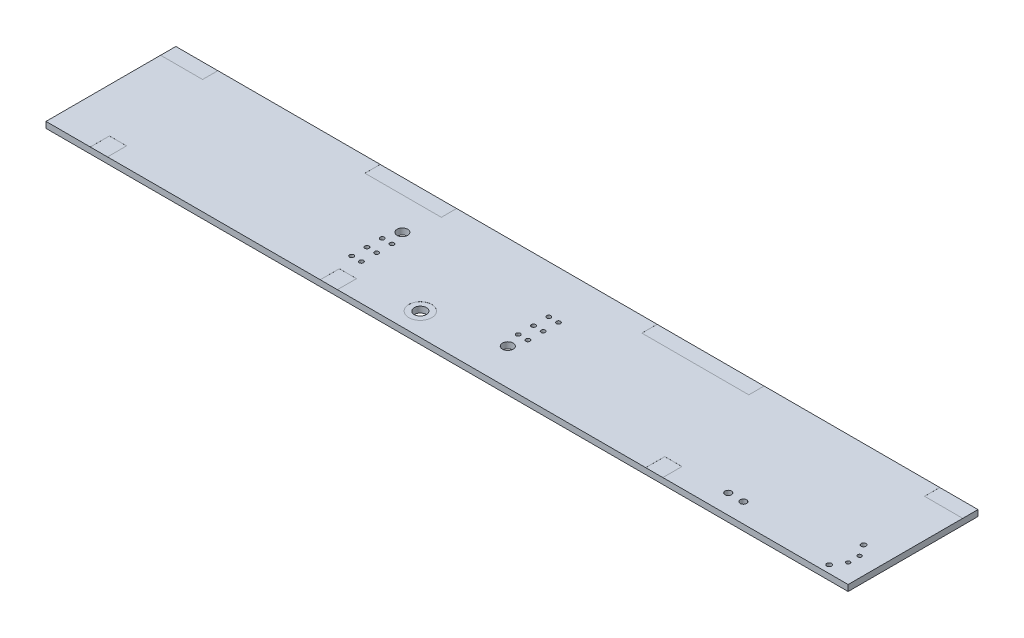
from build123d import *

# Parameters (mm, degrees)
ESQUISSE1_W                     = 210
ESQUISSE1_H                     = 1.6
BOARD_DEPTH                     = 34
SKETCH1_R                       = 0.55
SKETCH1_R_2                     = 1.4
REMOVEABLE_BATT_CON_HOLES_DEPTH = 118.625713289
SKETCH2_R                       = 0.51
SKETCH2_R_2                     = 0.635
DC_OUT_CONN_HOLES_DEPTH         = 118.625713289
SKETCH3_R                       = 0.85
CHARGER_CONN_HOLES_DEPTH        = 118.625713289
SKETCH4_R                       = 1.59
CUT_EXTRUDE1_DEPTH              = 118.625713289
SKETCH5_R                       = 3
SKETCH5_W                       = 10
SKETCH5_H                       = 4
SKETCH5_W_2                     = 28
SKETCH5_W_3                     = 20
SKETCH5_W_4                     = 11
SKETCH5_W_5                     = 4.5
SKETCH5_H_2                     = 5
CUT_EXTRUDE2_DEPTH              = 0.01
CUT_EXTRUDE3_START              = -1.59
SKETCH5_2_R                     = 3
SKETCH5_2_W                     = 10
SKETCH5_2_H                     = 4
SKETCH5_2_W_2                   = 28
SKETCH5_2_W_3                   = 20
SKETCH5_2_W_4                   = 11
SKETCH5_2_W_5                   = 4.5
SKETCH5_2_H_2                   = 5
CUT_EXTRUDE3_DEPTH              = 0.01
SKETCH6_W                       = 8
SKETCH6_H                       = 18
CUT_EXTRUDE4_DEPTH              = 0.001
SKETCH7_R                       = 4
BOSS_EXTRUDE1_DEPTH             = 10.2
BOSS_EXTRUDE2_DEPTH             = 3


with BuildPart() as part:
    # Esquisse1 → Board (new body)
    with BuildSketch(Plane.XY):
        with Locations((-7.593287663, -121.91)):
            Rectangle(ESQUISSE1_W, ESQUISSE1_H)
    extrude(amount=BOARD_DEPTH)

    # Sketch1 → Removeable Batt Con Holes (cut, through all)
    with BuildSketch(Plane(origin=(0, -122.71, 0), x_dir=(1, 0, 0), z_dir=(0, 1, 0))):
        with Locations(Location((-39.523287663, -16.5, 0), (0, 0, 180))):
            Circle(SKETCH1_R)
        with Locations(Location((-42.063287663, -16.5, 0), (0, 0, 180))):
            Circle(SKETCH1_R)
        with Locations(Location((-42.063287663, -20.5, 0), (0, 0, 180))):
            Circle(SKETCH1_R)
        with Locations(Location((-42.063287663, -24.5, 0), (0, 0, 180))):
            Circle(SKETCH1_R)
        with Locations((-40.793287663, -12.5)):
            Circle(SKETCH1_R_2)
        with Locations(Location((-39.523287663, -20.5, 0), (0, 0, 180))):
            Circle(SKETCH1_R)
        with Locations(Location((-39.523287663, -24.5, 0), (0, 0, 180))):
            Circle(SKETCH1_R)
        with Locations(Location((-2.463287663, -20.5, 0), (0, 0, 180))):
            Circle(SKETCH1_R)
        with Locations(Location((0.076712337, -20.5, 0), (0, 0, 180))):
            Circle(SKETCH1_R)
        with Locations(Location((-2.463287663, -16.5, 0), (0, 0, 180))):
            Circle(SKETCH1_R)
        with Locations(Location((0.076712337, -16.5, 0), (0, 0, 180))):
            Circle(SKETCH1_R)
        with Locations(Location((-2.463287663, -12.5, 0), (0, 0, 180))):
            Circle(SKETCH1_R)
        with Locations(Location((0.076712337, -12.5, 0), (0, 0, 180))):
            Circle(SKETCH1_R)
        with Locations((-1.193287663, -24.5)):
            Circle(SKETCH1_R_2)
    extrude(amount=REMOVEABLE_BATT_CON_HOLES_DEPTH, mode=Mode.SUBTRACT)

    # Sketch2 → DC Out Conn holes (cut, through all)
    with BuildSketch(Plane.XZ.offset(122.71)):
        with Locations((92.406712337, 29)):
            Circle(SKETCH2_R)
        with Locations((92.406712337, 26)):
            Circle(SKETCH2_R)
        with Locations((90.446712337, 32)):
            Circle(SKETCH2_R_2)
        with Locations((90.446712337, 23)):
            Circle(SKETCH2_R_2)
    extrude(amount=-DC_OUT_CONN_HOLES_DEPTH, mode=Mode.SUBTRACT)

    # Sketch3 → Charger conn holes (cut, through all)
    with BuildSketch(Plane.XZ.offset(122.71)):
        with Locations((64.906712337, 28.92)):
            Circle(SKETCH3_R)
        with Locations((60.946712337, 28.92)):
            Circle(SKETCH3_R)
    extrude(amount=-CHARGER_CONN_HOLES_DEPTH, mode=Mode.SUBTRACT)

    # Sketch4 → Cut-Extrude1 (cut, through all)
    with BuildSketch(Plane(origin=(0, -121.11, 0), x_dir=(1, 0, 0), z_dir=(0, 1, 0))):
        with Locations(Location((-20.593287663, -28, 0), (0, 0, 180))):
            Circle(SKETCH4_R)
    extrude(amount=-CUT_EXTRUDE1_DEPTH, mode=Mode.SUBTRACT)

    # Sketch5 → Cut-Extrude2 (cut)
    with BuildSketch(Plane(origin=(0, -121.11, 0), x_dir=(1, 0, 0), z_dir=(0, 1, 0))):
        with Locations(Location((-20.593287663, -28, 0), (0, 0, 180))):
            Circle(SKETCH5_R)
        with Locations((92.406712337, -2)):
            Rectangle(SKETCH5_W, SKETCH5_H)
        with Locations((27.406712337, -2)):
            Rectangle(SKETCH5_W_2, SKETCH5_H)
        with Locations((-49.093287663, -2)):
            Rectangle(SKETCH5_W_3, SKETCH5_H)
        with Locations((-107.093287663, -2)):
            Rectangle(SKETCH5_W_4, SKETCH5_H)
        with Locations((-98.743287663, -31.5)):
            Rectangle(SKETCH5_W_5, SKETCH5_H_2)
        with Locations((-38.543287663, -31.5)):
            Rectangle(SKETCH5_W_5, SKETCH5_H_2)
        with Locations((46.656712337, -31.5)):
            Rectangle(SKETCH5_W_5, SKETCH5_H_2)
    extrude(amount=-CUT_EXTRUDE2_DEPTH, mode=Mode.SUBTRACT)

    # Sketch5<2> → Cut-Extrude3 (cut)
    with BuildSketch(Plane(origin=(0, -121.11, 0), x_dir=(1, 0, 0), z_dir=(0, 1, 0)).offset(CUT_EXTRUDE3_START)):
        with Locations(Location((-20.593287663, -28, 0), (0, 0, 180))):
            Circle(SKETCH5_2_R)
        with Locations((92.406712337, -2)):
            Rectangle(SKETCH5_2_W, SKETCH5_2_H)
        with Locations((27.406712337, -2)):
            Rectangle(SKETCH5_2_W_2, SKETCH5_2_H)
        with Locations((-49.093287663, -2)):
            Rectangle(SKETCH5_2_W_3, SKETCH5_2_H)
        with Locations((-107.093287663, -2)):
            Rectangle(SKETCH5_2_W_4, SKETCH5_2_H)
        with Locations((-98.743287663, -31.5)):
            Rectangle(SKETCH5_2_W_5, SKETCH5_2_H_2)
        with Locations((-38.543287663, -31.5)):
            Rectangle(SKETCH5_2_W_5, SKETCH5_2_H_2)
        with Locations((46.656712337, -31.5)):
            Rectangle(SKETCH5_2_W_5, SKETCH5_2_H_2)
    extrude(amount=-CUT_EXTRUDE3_DEPTH, mode=Mode.SUBTRACT)

    # Sketch6 → Cut-Extrude4 (cut)
    with BuildSketch(Plane.XZ.offset(122.71)):
        Polygon((57.406712337, 34), (57.406712337, 15.5), (58.906712337, 15.5), (58.906712337, 5.5), (64.406712337, 0), (41.406712337, 0), (41.406712337, 4), (13.406712337, 4), (13.406712337, 0), (-39.093287663, 0), (-39.093287663, 4), (-59.093287663, 4), (-59.093287663, 0), (-101.593287663, 0), (-101.593287663, 4), (-112.593287663, 4), (-112.593287663, 34), (-100.993287663, 34), (-100.993287663, 29), (-96.493287663, 29), (-96.493287663, 34), (-40.793287663, 34), (-40.793287663, 29), (-36.293287663, 29), (-36.293287663, 34), (44.406712337, 34), (44.406712337, 29), (48.906712337, 29), (48.906712337, 34), align=None)
        with Locations((-40.793287663, 18.5)):
            Rectangle(SKETCH6_W, SKETCH6_H, mode=Mode.SUBTRACT)
        with Locations((-1.193287663, 18.5)):
            Rectangle(SKETCH6_W, SKETCH6_H, mode=Mode.SUBTRACT)
    extrude(amount=-CUT_EXTRUDE4_DEPTH, mode=Mode.SUBTRACT)

    # Sketch7 → Boss-Extrude1 (add)
    with BuildSketch(Plane.XZ.offset(122.71)):
        with Locations(Location((64.406712337, 17.5, 0), (0, 0, 180))):
            Circle(SKETCH7_R)
        with Locations(Location((64.406712337, 8, 0), (0, 0, 180))):
            Circle(SKETCH7_R)
    extrude(amount=BOSS_EXTRUDE1_DEPTH)

    # Sketch8 → Boss-Extrude2 (add)
    with BuildSketch(Plane.XZ.offset(122.71)):
        with BuildLine():
            Line((82.374312337, 7.884), (87.606712337, 7.884))
            Line((87.606712337, 7.884), (87.606712337, 6.354))
            ThreePointArc((87.606712337, 6.354), (84.990512337, 3.7378), (82.374312337, 6.354))
            Line((82.374312337, 6.354), (82.374312337, 7.884))
        make_face()
    extrude(amount=BOSS_EXTRUDE2_DEPTH)


solid = part.part
